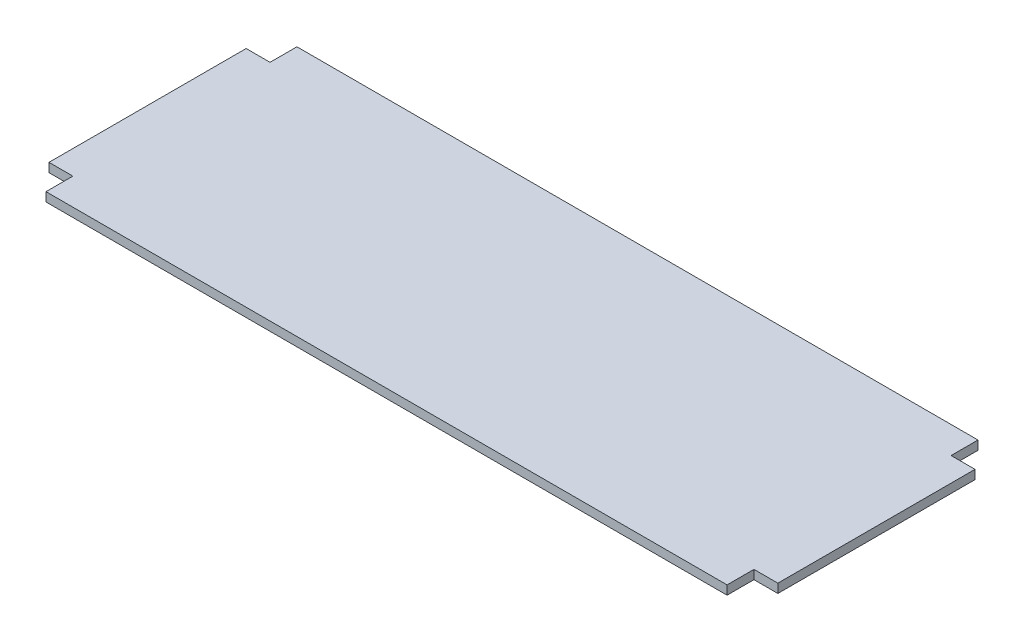
from build123d import *

# Parameters (mm, degrees)
ESBO_O1_W                = 1220
ESBO_O1_H                = 420
RESSALTO_EXTRUS_O1_DEPTH = 15
ESBO_O2_W                = 40
ESBO_O2_H                = 45
CORTE_EXTRUS_O1_DEPTH    = 15


with BuildPart() as part:
    # Esboço1 → Ressalto-extrusão1 (new body)
    with BuildSketch(Plane(origin=(0, 0, 0), x_dir=(1, 0, 0), z_dir=(0, 1, 0))):
        Rectangle(ESBO_O1_W, ESBO_O1_H)
    extrude(amount=RESSALTO_EXTRUS_O1_DEPTH)

    # Esboço2 → Corte-extrusão1 (cut)
    with BuildSketch(Plane(origin=(0, 15, 0), x_dir=(1, 0, 0), z_dir=(0, 1, 0))):
        with Locations((-590, 187.5)):
            Rectangle(ESBO_O2_W, ESBO_O2_H)
        with Locations((-590, -187.5)):
            Rectangle(ESBO_O2_W, ESBO_O2_H)
        with Locations((590, -187.5)):
            Rectangle(ESBO_O2_W, ESBO_O2_H)
        with Locations((590, 187.5)):
            Rectangle(ESBO_O2_W, ESBO_O2_H)
    extrude(amount=-CORTE_EXTRUS_O1_DEPTH, mode=Mode.SUBTRACT)


solid = part.part
